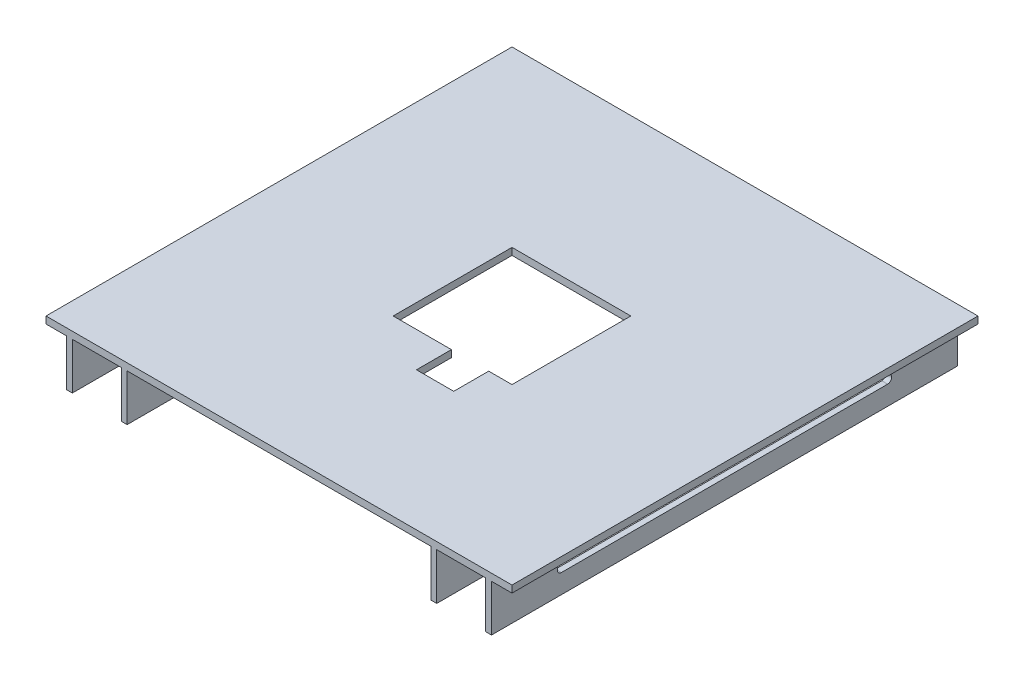
from build123d import *

# Parameters (mm, degrees)
SKETCH_1_W          = 200
SKETCH_1_H          = 200
EXTRUDE_1_DEPTH     = 3
SKETCH_2_W          = 2.5
SKETCH_2_H          = 200
EXTRUDE_2_DEPTH     = 20
CUT_EXTRUDE_2_DEPTH = 217.696654335
CUT_EXTRUDE_3_DEPTH = 10


with BuildPart() as part:
    # 草图1 → 凸台-拉伸1 (new body)
    with BuildSketch(Plane(origin=(0, 0, 0), x_dir=(1, 0, 0), z_dir=(0, 1, 0))):
        Rectangle(SKETCH_1_W, SKETCH_1_H)
    extrude(amount=EXTRUDE_1_DEPTH)

    # 草图2 → 凸台-拉伸2 (add)
    with BuildSketch(Plane.XZ):
        with Locations((-66.45, 0)):
            Rectangle(SKETCH_2_W, SKETCH_2_H)
        with Locations((-89.95, 0)):
            Rectangle(SKETCH_2_W, SKETCH_2_H)
    extrude_2 = extrude(amount=EXTRUDE_2_DEPTH)

    # 镜向1: 凸台-拉伸2 across plane
    add(extrude_2.mirror(Plane(origin=(0, 0, 0), x_dir=(0, 0, 1), z_dir=(1, 0, 0))))

    # 草图5 → 切除-拉伸2 (cut, through all)
    with BuildSketch(Plane(origin=(91.2, 0, 0), x_dir=(0, 0, -1), z_dir=(1, 0, 0))):
        with BuildLine():
            Line((-70, -8.25), (70, -8.25))
            ThreePointArc((70, -8.25), (71.75, -10), (70, -11.75))
            Line((70, -11.75), (-70, -11.75))
            ThreePointArc((-70, -11.75), (-71.75, -10), (-70, -8.25))
        make_face()
    extrude(amount=-CUT_EXTRUDE_2_DEPTH, mode=Mode.SUBTRACT)

    # 草图4 → 切除-拉伸3 (cut)
    with BuildSketch(Plane(origin=(0, 3, 0), x_dir=(1, 0, 0), z_dir=(0, 1, 0))):
        Polygon((15.5, -25.5), (15.5, -40.5), (-0.5, -40.5), (-0.5, -25.5), (-25.5, -25.5), (-25.5, 25.5), (25.5, 25.5), (25.5, -25.5), align=None)
    extrude(amount=-CUT_EXTRUDE_3_DEPTH, mode=Mode.SUBTRACT)


solid = part.part
